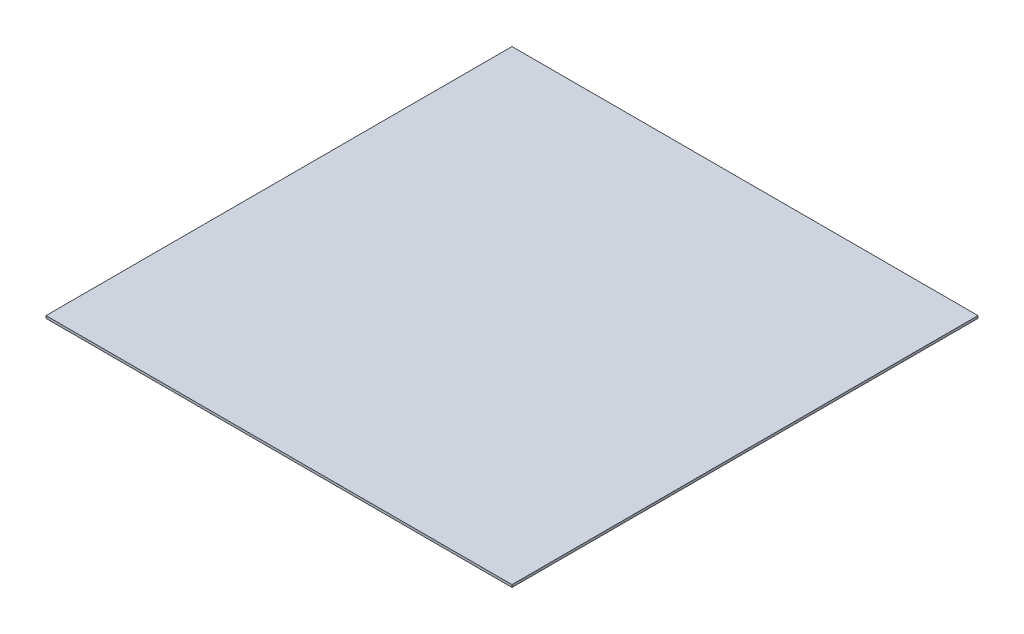
from build123d import *

# Parameters (mm, degrees)
SKETCH1_W           = 566
SKETCH1_H           = 566
BOSS_EXTRUDE1_DEPTH = 3


with BuildPart() as part:
    # Sketch1 → Boss-Extrude1 (new body)
    with BuildSketch(Plane(origin=(0, 0, 0), x_dir=(1, 0, 0), z_dir=(0, 1, 0))):
        with Locations((283, 283)):
            Rectangle(SKETCH1_W, SKETCH1_H)
    extrude(amount=BOSS_EXTRUDE1_DEPTH)


solid = part.part
